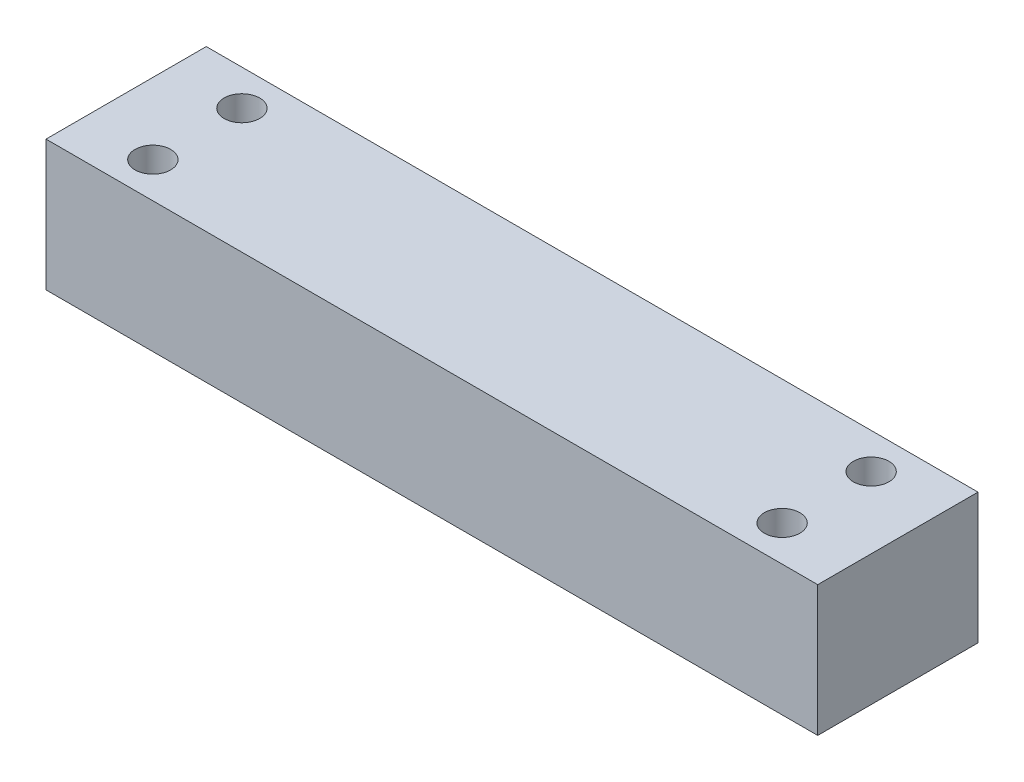
from build123d import *

# Parameters (mm, degrees)
SKETCH1_W           = 130
SKETCH1_H           = 27
SKETCH1_R           = 3
BOSS_EXTRUDE1_DEPTH = 22


with BuildPart() as part:
    # Sketch1 → Boss-Extrude1 (new body)
    with BuildSketch(Plane(origin=(0, 0, 0), x_dir=(1, 0, 0), z_dir=(0, 1, 0))):
        Rectangle(SKETCH1_W, SKETCH1_H)
        with Locations(Location((53, 7.5, 0), (0, 0, 270))):
            Circle(SKETCH1_R, mode=Mode.SUBTRACT)
        with Locations(Location((53, -7.5, 0), (0, 0, 270))):
            Circle(SKETCH1_R, mode=Mode.SUBTRACT)
        with Locations(Location((-53, 7.5, 0), (0, 0, 270))):
            Circle(SKETCH1_R, mode=Mode.SUBTRACT)
        with Locations(Location((-53, -7.5, 0), (0, 0, 270))):
            Circle(SKETCH1_R, mode=Mode.SUBTRACT)
    extrude(amount=BOSS_EXTRUDE1_DEPTH)


solid = part.part
